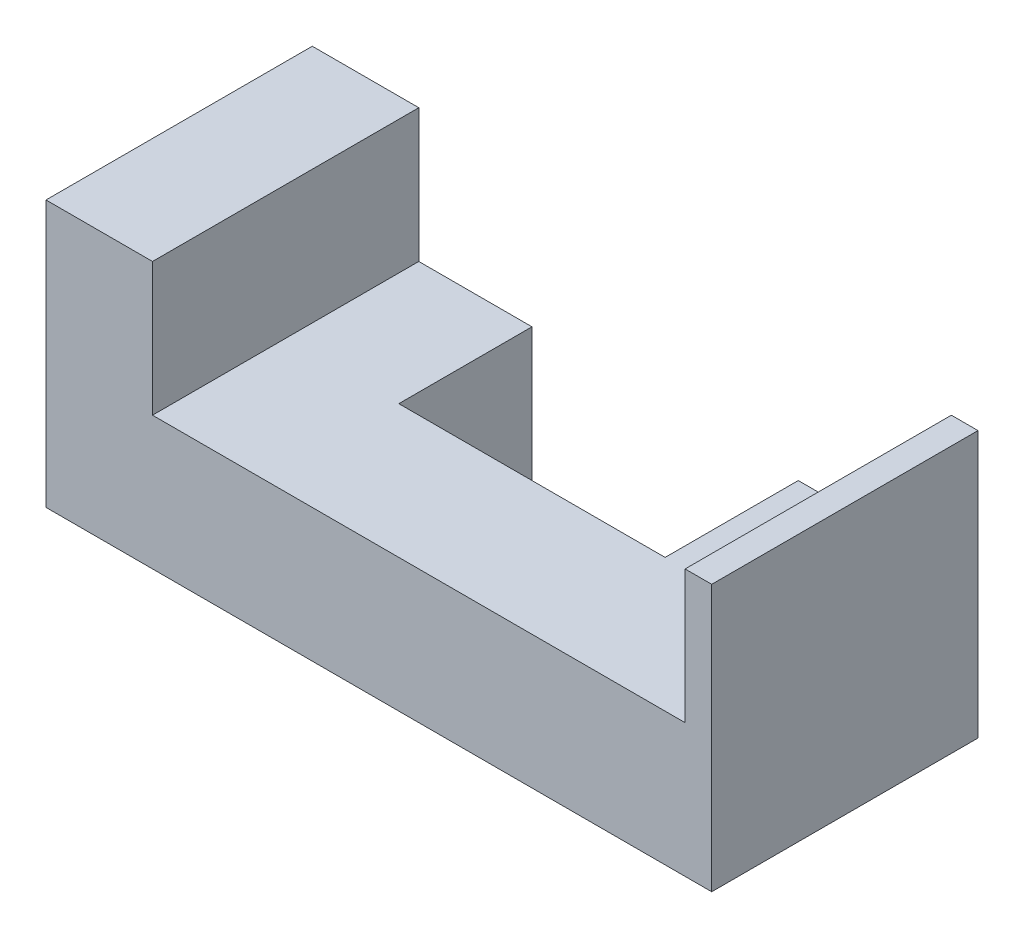
from build123d import *

# Parameters (mm, degrees)
EXTRUDE_1_DEPTH     = 20
SKETCH_2_W          = 20
SKETCH_2_H          = 10
CUT_EXTRUDE_1_DEPTH = 10


with BuildPart() as part:
    # 草圖1 → 填料-伸長1 (new body)
    with BuildSketch(Plane.XY):
        Polygon((-17, 10), (-25, 10), (-25, -10), (25, -10), (25, 10), (23, 10), (23, 0), (-17, 0), align=None)
    extrude(amount=EXTRUDE_1_DEPTH)

    # 草圖2 → 除料-伸長1 (cut)
    with BuildSketch(Plane(origin=(0, 0, 0), x_dir=(1, 0, 0), z_dir=(0, 1, 0))):
        with Locations((1.5, -5)):
            Rectangle(SKETCH_2_W, SKETCH_2_H)
    extrude(amount=-CUT_EXTRUDE_1_DEPTH, mode=Mode.SUBTRACT)


solid = part.part
